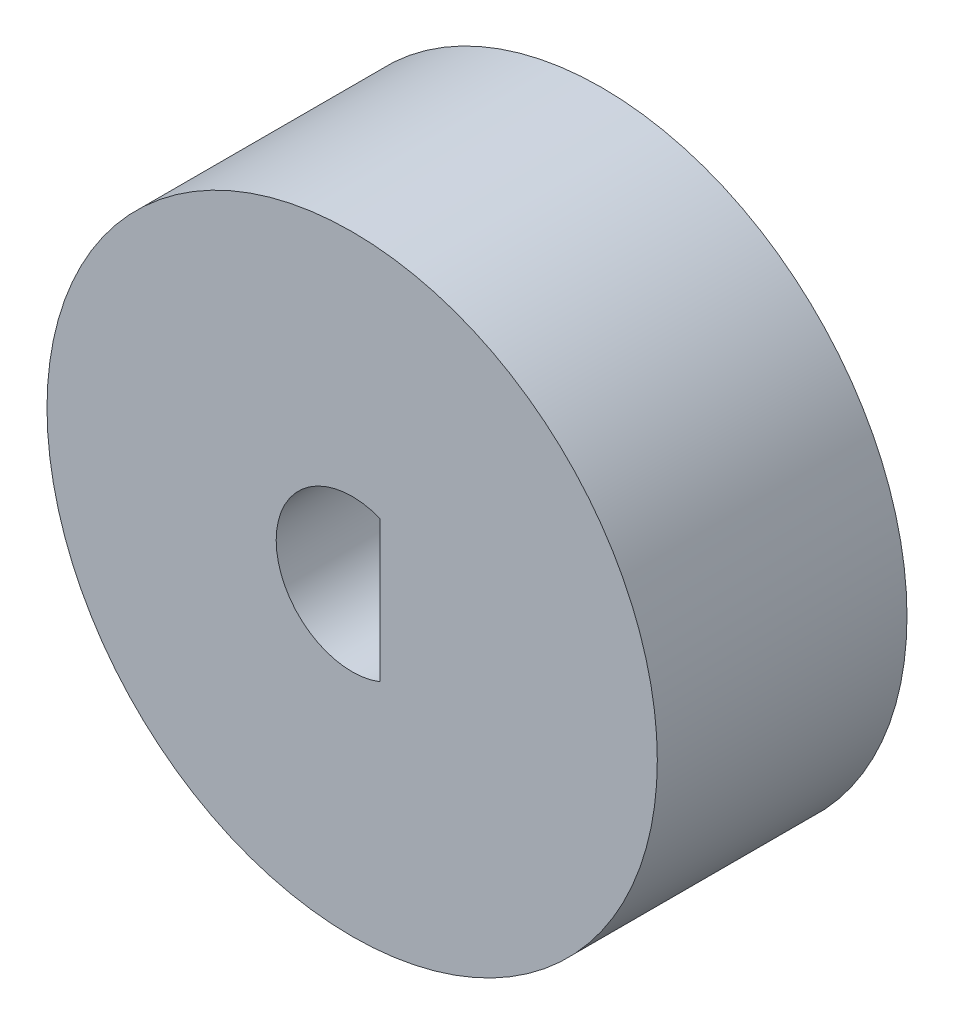
from build123d import *

# Parameters (mm, degrees)
SKETCH_1_R      = 22
EXTRUDE_1_DEPTH = 18


with BuildPart() as part:
    # 草图1 → 凸台-拉伸1 (new body)
    with BuildSketch(Plane.XY):
        Circle(SKETCH_1_R)
        with BuildLine():
            Line((2, -5.1), (2, 5.1))
            ThreePointArc((2, 5.1), (-5.47813837, 0), (2, -5.1))
        make_face(mode=Mode.SUBTRACT)
    extrude(amount=EXTRUDE_1_DEPTH)


solid = part.part
